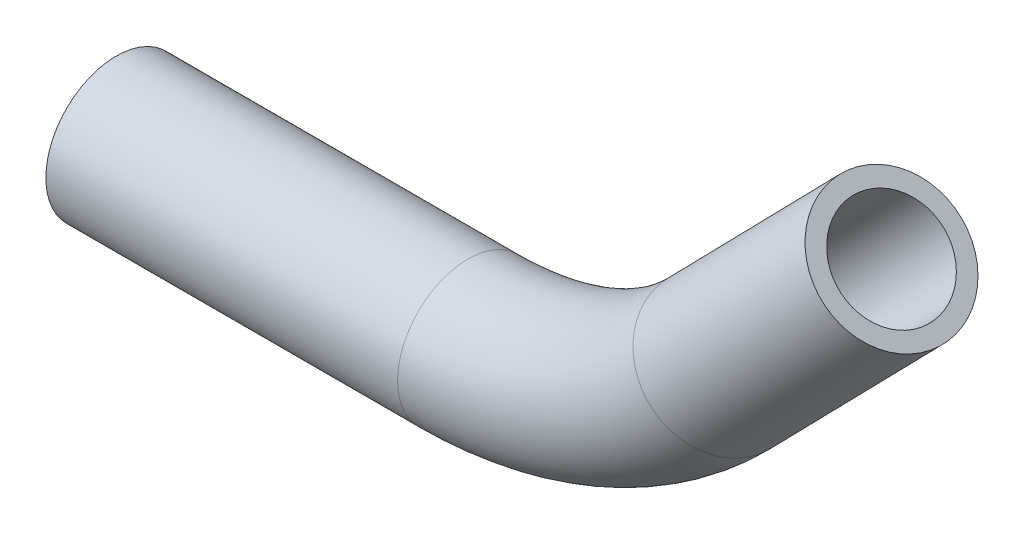
from build123d import *

# Parameters (mm, degrees)
SKETCH_2_R   = 4
SKETCH_2_R_2 = 3


with BuildPart() as part:
    # По траектории1: sweep along a path in Эскиз1
    with BuildLine(Plane.XY) as sweep_1_path:
        Line((0, 0), (20, 0))
        ThreePointArc((20, 0), (27.762116202, 1.567703559), (34.307362683, 6.025044793))
        Line((34.307362683, 6.025044793), (44.089831328, 16.040198671))
    # Эскиз2 → По траектории1 (sweep)
    with BuildSketch(Plane(origin=(0, 0, 0), x_dir=(0, 0, -1), z_dir=(1, 0, 0))):
        Circle(SKETCH_2_R)
        Circle(SKETCH_2_R_2, mode=Mode.SUBTRACT)
    sweep(path=sweep_1_path.line)


solid = part.part
